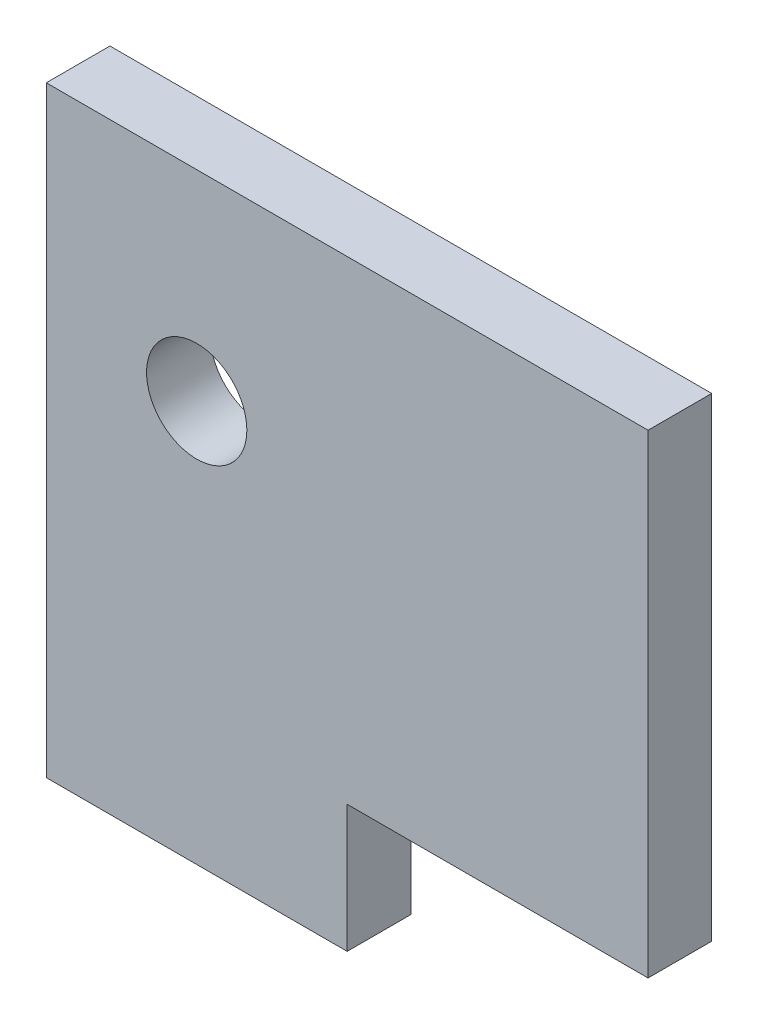
from build123d import *

# Parameters (mm, degrees)
SKETCH1_R           = 2.5
BOSS_EXTRUDE1_DEPTH = 3.175


with BuildPart() as part:
    # Sketch1 → Boss-Extrude1 (new body)
    with BuildSketch(Plane.XY):
        Polygon((15, 0), (15, 6.35), (30, 6.35), (30, 30), (0, 30), (0, 0), align=None)
        with Locations((7.5, 20)):
            Circle(SKETCH1_R, mode=Mode.SUBTRACT)
    extrude(amount=BOSS_EXTRUDE1_DEPTH)


solid = part.part
